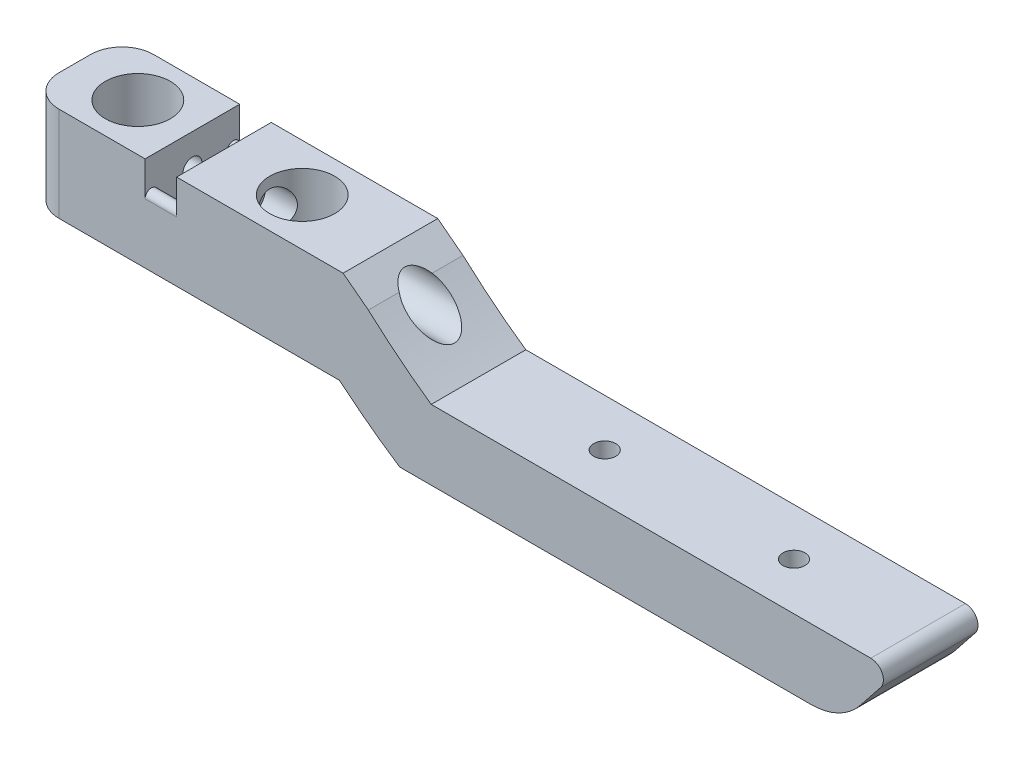
from build123d import *

# Parameters (mm, degrees)
EXTRUDE_1_DEPTH          = 15
SKETCH_2_R               = 5.15
CUT_EXTRUDE_1_DEPTH      = 15
EXTRUDE_3_DEPTH          = 15
SKETCH_5_W               = 5
SKETCH_5_H               = 10
CUT_EXTRUDE_3_DEPTH      = 15
CUT_EXTRUDE_4_DEPTH      = 15
CUT_EXTRUDE_4_DEPTH_BACK = 27
SKETCH_6_R               = 3.25
SKETCH_7_R               = 1.5
CUT_EXTRUDE_5_DEPTH      = 3.5
CUT_EXTRUDE_7_DEPTH      = 15
EXTRUDE_4_REACH          = 135.688
SKETCH_12_R              = 1.75
CUT_EXTRUDE_9_DEPTH      = 50
CUT_EXTRUDE_10_DEPTH     = 3
SKETCH_14_R              = 1.65
CUT_EXTRUDE_11_DEPTH     = 5
SKETCH_15_R              = 5.15
CUT_EXTRUDE_12_DEPTH     = 15
CUT_EXTRUDE_13_DEPTH     = 15
CUT_EXTRUDE_14_DEPTH     = 15
SKETCH_18_W              = 30
SKETCH_18_H              = 15
CUT_EXTRUDE_15_DEPTH     = 15
CUT_EXTRUDE_16_DEPTH     = 135
FILLET_3_R               = 10
FILLET_4_R               = 2
FILLET_5_R               = 5
EXTRUDE_5_DEPTH          = 5
FILLET_6_R               = 1
CUT_EXTRUDE_17_DEPTH     = 0.5
SKETCH_22_R              = 1.65
EXTRUDE_6_DEPTH          = 0.5
SCALE_1_SCALE            = 0.6


with BuildPart() as part:
    # 草图1 → 凸台-拉伸1 (new body)
    with BuildSketch(Plane.XY):
        with BuildLine():
            Line((40, 7.5), (-40, 7.5))
            Line((-40, 7.5), (-40, -7.5))
            Line((-40, -7.5), (39.456922296, -7.5))
            add(Edge.make_bspline(
                [(39.456922296, -7.5), (46.411815441, -13.348879485), (59.483442953, -20.788944656), (71.646457346, -24.94425278), (84, -26.35191574), (96.353542654, -24.94425278), (108.516557047, -20.788944656), (123.382931224, -12.327351589), (132.036036764, -4.43964044)],
                knots=[0.037726639, 0.037726639, 0.037726639, 0.1875, 0.3125, 0.4375, 0.5625, 0.6875, 0.8125, 1, 1, 1], degree=2))
            Line((132.036036764, -4.43964044), (123.963963236, 4.43964044))
            add(Edge.make_bspline(
                [(44.036036764, 4.43964044), (51.882931224, -2.672648411), (64.516557047, -9.836055344), (74.353542654, -13.18074722), (84, -14.27308426), (93.646457346, -13.18074722), (103.483442953, -9.836055344), (116.117068776, -2.672648411), (123.963963236, 4.43964044)],
                knots=[0, 0, 0, 0.1875, 0.3125, 0.4375, 0.5625, 0.6875, 0.8125, 1, 1, 1], degree=2))
            Line((44.036036764, 4.43964044), (40, 7.5))
        make_face()
    extrude(amount=EXTRUDE_1_DEPTH)

    # 草图2 → 切除-拉伸1 (cut)
    with BuildSketch(Plane(origin=(0, 7.5, 0), x_dir=(1, 0, 0), z_dir=(0, 1, 0))):
        with Locations(Location((0, -7.5, 0), (0, 0, 270))):
            Circle(SKETCH_2_R)
    extrude(amount=-CUT_EXTRUDE_1_DEPTH, mode=Mode.SUBTRACT)

    # 草图4 → 凸台-拉伸3 (add)
    with BuildSketch(Plane(origin=(0, 0, 0), x_dir=(-1, 0, 0), z_dir=(0, 0, -1))):
        Polygon((-40, 7.5), (-44.036036764, 7.5), (-44.036036764, 4.43964044), align=None)
    extrude(amount=-EXTRUDE_3_DEPTH)

    # 草图5 → 切除-拉伸3 (cut)
    with BuildSketch(Plane(origin=(0, 0, 0), x_dir=(-1, 0, 0), z_dir=(0, 0, -1))):
        with Locations((-11.65, 2.5)):
            Rectangle(SKETCH_5_W, SKETCH_5_H)
    extrude(amount=-CUT_EXTRUDE_3_DEPTH, mode=Mode.SUBTRACT)

    # 草图6 → 切除-拉伸4 (cut, two sides: drawn at the far end of the back side and taken through both)
    with BuildSketch(Plane(origin=(44.036036764, 0, 0), x_dir=(0, 0, -1), z_dir=(1, 0, 0)).offset(-CUT_EXTRUDE_4_DEPTH_BACK)):
        with Locations(Location((-7.5, 2.5, 0), (0, 0, 143.358054803))):
            Circle(SKETCH_6_R)
    extrude(amount=CUT_EXTRUDE_4_DEPTH + CUT_EXTRUDE_4_DEPTH_BACK, mode=Mode.SUBTRACT)

    # 草图7 → 切除-拉伸5 (cut)
    with BuildSketch(Plane(origin=(9.15, 0, 0), x_dir=(0, 0, -1), z_dir=(1, 0, 0))):
        with Locations((-7.5, 2.5)):
            Circle(SKETCH_7_R)
    extrude(amount=-CUT_EXTRUDE_5_DEPTH, mode=Mode.SUBTRACT)

    # 草图9 → 切除-拉伸7 (cut)
    with BuildSketch(Plane(origin=(0, 0, 0), x_dir=(-1, 0, 0), z_dir=(0, 0, -1))):
        with BuildLine():
            Line((-49, -14.628935139), (-119, -14.628935139))
            add(Edge.make_bspline(
                [(-49, -14.628935139), (-51.259755236, -16.108213622), (-59.483442953, -20.788944656), (-71.646457346, -24.94425278), (-84, -26.35191574), (-96.353542654, -24.94425278), (-108.516557047, -20.788944656), (-116.740244764, -16.108213622), (-119, -14.628935139)],
                knots=[0.139633208, 0.139633208, 0.139633208, 0.1875, 0.3125, 0.4375, 0.5625, 0.6875, 0.8125, 0.860366792, 0.860366792, 0.860366792], degree=2))
        make_face()
    extrude(amount=-CUT_EXTRUDE_7_DEPTH, mode=Mode.SUBTRACT)

    # 凸台-拉伸4: up to this face of the body (flat: up to its plane)
    extrude_4_end = Plane(part.part.faces().sort_by_distance((30.242148565, -2.823725013, 15))[0])
    # 草图10 → 凸台-拉伸4 (add, up to the picked face)
    with BuildSketch(Plane(origin=(0, 0, 0), x_dir=(-1, 0, 0), z_dir=(0, 0, -1)), mode=Mode.PRIVATE) as extrude_4_sk1:
        with BuildLine():
            Line((-114, -3.531559291), (-54, -3.531559291))
            add(Edge.make_bspline(
                [(-54, -3.531559291), (-56.748654683, -5.431567952), (-64.516557047, -9.836055344), (-74.353542654, -13.18074722), (-84, -14.27308426), (-93.646457346, -13.18074722), (-103.483442953, -9.836055344), (-111.251345317, -5.431567952), (-114, -3.531559291)],
                knots=[0.120356468, 0.120356468, 0.120356468, 0.1875, 0.3125, 0.4375, 0.5625, 0.6875, 0.8125, 0.879643532, 0.879643532, 0.879643532], degree=2))
        make_face()
    extrude_4_tool1 = split(extrude(extrude_4_sk1.sketch, amount=-EXTRUDE_4_REACH, mode=Mode.PRIVATE), bisect_by=extrude_4_end, keep=Keep.BOTH, mode=Mode.PRIVATE)
    add(extrude_4_tool1.solids().sort_by(Axis((84, -7.71433, 0), (0, 0, 1)))[0])

    # 草图12 → 切除-拉伸9 (cut)
    with BuildSketch(Plane(origin=(0, -3.531559291, 0), x_dir=(1, 0, 0), z_dir=(0, 1, 0))):
        with Locations(Location((74.000000001, -7.5, 0), (0, 0, 180))):
            Circle(SKETCH_12_R)
        with Locations(Location((104.000000001, -7.5, 0), (0, 0, 180))):
            Circle(SKETCH_12_R)
    extrude(amount=-CUT_EXTRUDE_9_DEPTH, mode=Mode.SUBTRACT)

    # 草图13 → 切除-拉伸10 (cut)
    with BuildSketch(Plane.XZ.offset(14.628935139)):
        Polygon((75.674315782, 4.6), (77.348631563, 7.5), (75.674315782, 10.4), (72.325684221, 10.4), (70.65136844, 7.5), (72.325684221, 4.6), align=None)
        Polygon((105.674315782, 4.6), (107.348631563, 7.5), (105.674315782, 10.4), (102.325684221, 10.4), (100.65136844, 7.5), (102.325684221, 4.6), align=None)
    extrude(amount=-CUT_EXTRUDE_10_DEPTH, mode=Mode.SUBTRACT)

    # 草图14 → 切除-拉伸11 (cut)
    with BuildSketch(Plane(origin=(17.036036764, 0, 0), x_dir=(0, 0, -1), z_dir=(1, 0, 0))):
        with Locations((-7.5, 2.5)):
            Circle(SKETCH_14_R)
    extrude(amount=-CUT_EXTRUDE_11_DEPTH, mode=Mode.SUBTRACT)

    # 草图15 → 切除-拉伸12 (cut)
    with BuildSketch(Plane(origin=(0, 7.5, 0), x_dir=(1, 0, 0), z_dir=(0, 1, 0))):
        with Locations(Location((26.05, -7.5, 0), (0, 0, 270))):
            Circle(SKETCH_15_R)
    extrude(amount=-CUT_EXTRUDE_12_DEPTH, mode=Mode.SUBTRACT)

    # 草图16 → 切除-拉伸13 (cut)
    with BuildSketch(Plane(origin=(0, 0, 0), x_dir=(-1, 0, 0), z_dir=(0, 0, -1))):
        Polygon((-44.036036764, 4.43964044), (-40.036036764, 7.5), (-44.036036764, 7.5), align=None)
    extrude(amount=-CUT_EXTRUDE_13_DEPTH, mode=Mode.SUBTRACT)

    # 草图17 → 切除-拉伸14 (cut)
    with BuildSketch(Plane(origin=(0, 0, 0), x_dir=(-1, 0, 0), z_dir=(0, 0, -1))):
        Polygon((-114, -3.531559291), (-155.45087664, -3.531559291), (-96.986746886, 29.708253825), align=None)
    extrude(amount=-CUT_EXTRUDE_14_DEPTH, mode=Mode.SUBTRACT)

    # 草图18 → 切除-拉伸15 (cut)
    with BuildSketch(Plane(origin=(0, 0, 0), x_dir=(-1, 0, 0), z_dir=(0, 0, -1))):
        with Locations((25, 0)):
            Rectangle(SKETCH_18_W, SKETCH_18_H)
    extrude(amount=-CUT_EXTRUDE_15_DEPTH, mode=Mode.SUBTRACT)

    # 草图19 → 切除-拉伸16 (cut)
    with BuildSketch(Plane.XY.offset(15)):
        Polygon((119, -14.628935139), (127.815134708, -3.531559292), (136.052125617, -3.531559292), align=None)
    extrude(amount=-CUT_EXTRUDE_16_DEPTH, mode=Mode.SUBTRACT)

    # 圆角3
    fillet_3_edges = [part.edges().sort_by_distance(p)[0] for p in [
        (119, -14.628935139, 7.5),
    ]]
    fillet(fillet_3_edges, radius=FILLET_3_R)

    # 圆角4
    fillet_4_edges = [part.edges().sort_by_distance(p)[0] for p in [
        (127.815134708, -3.531559292, 7.5),
    ]]
    fillet(fillet_4_edges, radius=FILLET_4_R)

    # 圆角5
    fillet_5_edges = [part.edges().sort_by_distance(p)[0] for p in [
        (-10, 0, 15),
        (-10, 0, 0),
    ]]
    fillet(fillet_5_edges, radius=FILLET_5_R)

    # 草图20 → 凸台-拉伸5 (add)
    with BuildSketch(Plane(origin=(9.15, 0, 0), x_dir=(0, 0, -1), z_dir=(1, 0, 0))):
        Polygon((-10, -2.5), (-15, -2.5), (-15, 5.5), align=None)
        Polygon((0, 5.5), (-5, -2.5), (0, -2.5), align=None)
    extrude(amount=EXTRUDE_5_DEPTH)

    # 圆角6
    fillet_6_edges = [part.edges().sort_by_distance(p)[0] for p in [
        (11.65, 5.5, 15),
        (11.65, 5.5, 0),
    ]]
    fillet(fillet_6_edges, radius=FILLET_6_R)

    # 草图21 → 切除-拉伸17 (cut)
    with BuildSketch(Plane(origin=(9.15, 0, 0), x_dir=(0, 0, -1), z_dir=(1, 0, 0))):
        with BuildLine():
            Line((-5, -2.5), (-1.847998304, 2.543202714))
            ThreePointArc((-1.847998304, 2.543202714), (-0.724317487, 2.97445252), (0, 2.013203774))
            Line((0, 2.013203774), (0, 7.5))
            Line((0, 7.5), (-15, 7.5))
            Line((-15, 7.5), (-15, 2.013203774))
            ThreePointArc((-15, 2.013203774), (-14.275682513, 2.97445252), (-13.152001696, 2.543202714))
            Line((-13.152001696, 2.543202714), (-10, -2.5))
            Line((-10, -2.5), (-5, -2.5))
        make_face()
    extrude(amount=-CUT_EXTRUDE_17_DEPTH, mode=Mode.SUBTRACT)

    # 草图22 → 凸台-拉伸6 (add)
    with BuildSketch(Plane.ZY.offset(-14.15)):
        with BuildLine():
            Line((0, 7.5), (0, 2.013203774))
            ThreePointArc((0, 2.013203774), (0.724317487, 2.97445252), (1.847998304, 2.543202714))
            Line((1.847998304, 2.543202714), (5, -2.5))
            Line((5, -2.5), (10, -2.5))
            Line((10, -2.5), (13.152001696, 2.543202714))
            ThreePointArc((13.152001696, 2.543202714), (14.275682513, 2.97445252), (15, 2.013203774))
            Line((15, 2.013203774), (15, 7.5))
            Line((15, 7.5), (0, 7.5))
        make_face()
        with Locations(Location((7.5, 2.5, 0), (0, 0, 180))):
            Circle(SKETCH_22_R, mode=Mode.SUBTRACT)
    extrude(amount=EXTRUDE_6_DEPTH)


with BuildPart() as part_1:
    # 缩放比例1: scaled about (0, 0, 0)
    add(part.part.scale(SCALE_1_SCALE))


solid = part_1.part
